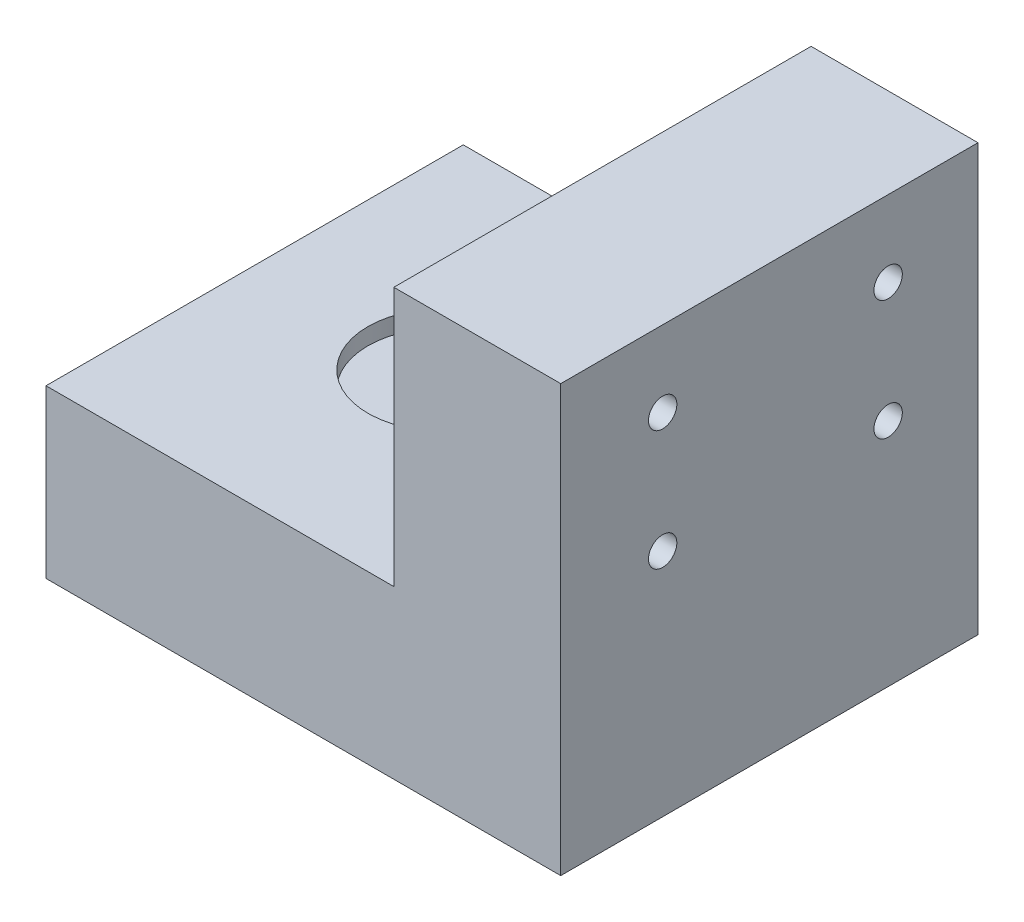
from build123d import *

# Parameters (mm, degrees)
BOSS_EXTRUDE1_DEPTH = 50
SKETCH2_R           = 1.7
CUT_EXTRUDE2_DEPTH  = 75.542415548
SKETCH3_R           = 3
CUT_EXTRUDE3_DEPTH  = 119.507616013
SKETCH4_R           = 9
CUT_EXTRUDE4_DEPTH  = 2


with BuildPart() as part:
    # Sketch1 → Boss-Extrude1 (new body)
    with BuildSketch(Plane.XY):
        Polygon((-41.176470588, 14.736470588), (-41.176470588, -36.323529412), (-102.855877095, -36.323529412), (-102.855877095, -16.323529412), (-61.176470588, -16.323529412), (-61.176470588, 14.736470588), align=None)
    extrude(amount=BOSS_EXTRUDE1_DEPTH)

    # Sketch2 → Cut-Extrude2 (cut, through all)
    with BuildSketch(Plane.ZY.offset(61.176470588)):
        with Locations((10.768169464, 5.635466658)):
            Circle(SKETCH2_R)
        with Locations((37.786974644, 5.635466658)):
            Circle(SKETCH2_R)
        with Locations((10.768169464, -8.740849467)):
            Circle(SKETCH2_R)
        with Locations((37.786974644, -8.740849467)):
            Circle(SKETCH2_R)
    extrude(amount=-CUT_EXTRUDE2_DEPTH, mode=Mode.SUBTRACT)

    # Sketch3 → Cut-Extrude3 (cut, through all)
    with BuildSketch(Plane(origin=(0, -16.323529412, 0), x_dir=(1, 0, 0), z_dir=(0, 1, 0))):
        with Locations(Location((-80.712404336, -24.573120592, 0), (0, 0, 180))):
            Circle(SKETCH3_R)
    extrude(amount=-CUT_EXTRUDE3_DEPTH, mode=Mode.SUBTRACT)

    # Sketch4 → Cut-Extrude4 (cut)
    with BuildSketch(Plane(origin=(0, -16.323529412, 0), x_dir=(1, 0, 0), z_dir=(0, 1, 0))):
        with Locations(Location((-80.712404336, -24.573120592, 0), (0, 0, 180))):
            Circle(SKETCH4_R)
    extrude(amount=-CUT_EXTRUDE4_DEPTH, mode=Mode.SUBTRACT)


solid = part.part
